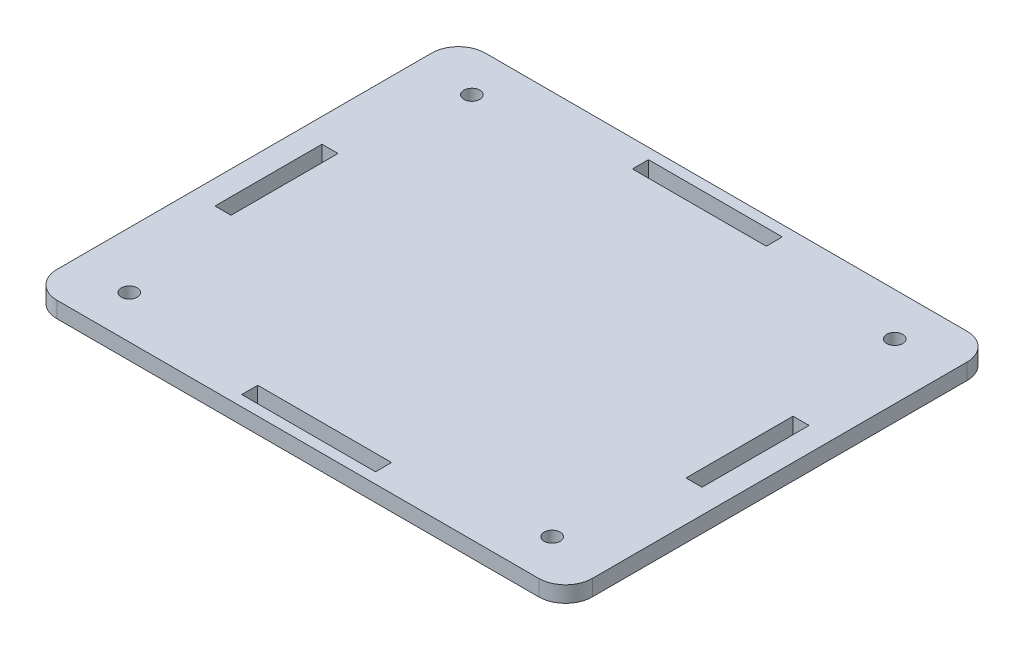
from build123d import *

# Parameters (mm, degrees)
SKETCH1_W           = 100
SKETCH1_H           = 80
BOSS_EXTRUDE1_DEPTH = 3
FILLET1_R           = 5
SKETCH2_R           = 1.5
CUT_EXTRUDE1_DEPTH  = 3
SKETCH3_W           = 25
SKETCH3_H           = 3
SKETCH3_W_2         = 3
SKETCH3_H_2         = 20
CUT_EXTRUDE2_DEPTH  = 10


with BuildPart() as part:
    # Sketch1 → Boss-Extrude1 (new body)
    with BuildSketch(Plane(origin=(0, 0, 0), x_dir=(1, 0, 0), z_dir=(0, 1, 0))):
        Rectangle(SKETCH1_W, SKETCH1_H)
    extrude(amount=BOSS_EXTRUDE1_DEPTH)

    # Fillet1
    fillet1_edges = [part.edges().sort_by_distance(p)[0] for p in [
        (50, 1.5, 40),
        (-50, 1.5, 40),
        (-50, 1.5, -40),
        (50, 1.5, -40),
    ]]
    fillet(fillet1_edges, radius=FILLET1_R)

    # Sketch2 → Cut-Extrude1 (cut)
    with BuildSketch(Plane(origin=(0, 3, 0), x_dir=(1, 0, 0), z_dir=(0, 1, 0))):
        with Locations(Location((39.5, -32, 0), (0, 0, 270))):
            Circle(SKETCH2_R)
        with Locations(Location((39.5, 32, 0), (0, 0, 270))):
            Circle(SKETCH2_R)
        with Locations(Location((-39.5, 32, 0), (0, 0, 270))):
            Circle(SKETCH2_R)
        with Locations(Location((-39.5, -32, 0), (0, 0, 270))):
            Circle(SKETCH2_R)
    extrude(amount=-CUT_EXTRUDE1_DEPTH, mode=Mode.SUBTRACT)

    # Sketch3 → Cut-Extrude2 (cut)
    with BuildSketch(Plane(origin=(0, 3, 0), x_dir=(1, 0, 0), z_dir=(0, 1, 0))):
        with Locations((0, -36.5)):
            Rectangle(SKETCH3_W, SKETCH3_H)
        with Locations((0, 36.5)):
            Rectangle(SKETCH3_W, SKETCH3_H)
        with Locations((44, 0)):
            Rectangle(SKETCH3_W_2, SKETCH3_H_2)
        with Locations((-44, 0)):
            Rectangle(SKETCH3_W_2, SKETCH3_H_2)
    extrude(amount=-CUT_EXTRUDE2_DEPTH, mode=Mode.SUBTRACT)


solid = part.part
